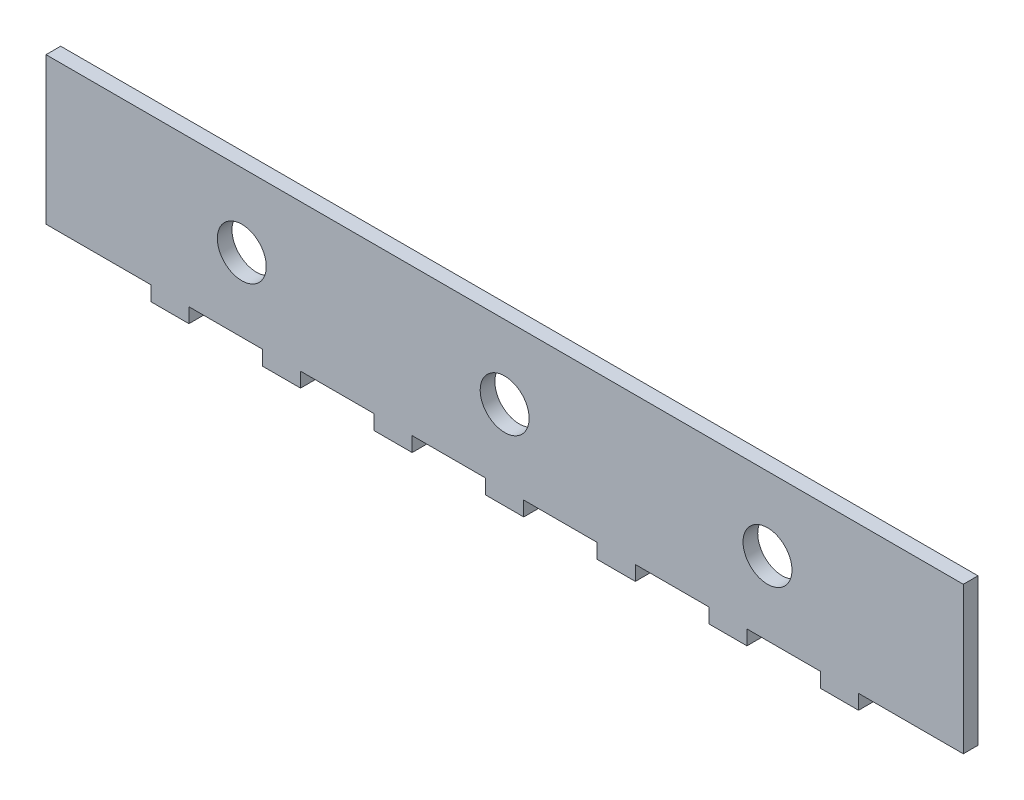
from build123d import *

# Parameters (mm, degrees)
SKETCH1_W           = 187.4
SKETCH1_H           = 30
BOSS_EXTRUDE1_DEPTH = 3
SKETCH2_W           = 7.8
SKETCH2_H           = 3
BOSS_EXTRUDE2_DEPTH = 3
LPATTERN2_COUNT     = 4
LPATTERN2_PITCH     = 22.8
LPATTERN2_COL_COUNT = 4
LPATTERN2_COL_PITCH = 22.8
SKETCH3_R           = 5
CUT_EXTRUDE1_DEPTH  = 96.460410642


with BuildPart() as part:
    # Sketch1 → Boss-Extrude1 (new body)
    with BuildSketch(Plane.XY):
        Rectangle(SKETCH1_W, SKETCH1_H)
    extrude(amount=BOSS_EXTRUDE1_DEPTH)

    # Sketch2 → Boss-Extrude2 (add)
    with BuildSketch(Plane.XZ.offset(15)):
        with Locations((0, 1.5)):
            Rectangle(SKETCH2_W, SKETCH2_H)
    boss_extrude2 = extrude(amount=BOSS_EXTRUDE2_DEPTH)

    # LPattern2: Boss-Extrude2 ×4
    with Locations(*[(i * LPATTERN2_PITCH, 0, 0) for i in range(1, LPATTERN2_COUNT)]):
        add(boss_extrude2)

    # LPattern2 col: Boss-Extrude2 ×4
    with Locations(*[(-i * LPATTERN2_COL_PITCH, 0, 0) for i in range(1, LPATTERN2_COL_COUNT)]):
        add(boss_extrude2)

    # Sketch3 → Cut-Extrude1 (cut, through all)
    with BuildSketch(Plane(origin=(0, 0, 0), x_dir=(-1, 0, 0), z_dir=(0, 0, -1))):
        Circle(SKETCH3_R)
        with Locations((-53.7, 0)):
            Circle(SKETCH3_R)
        with Locations((53.7, 0)):
            Circle(SKETCH3_R)
    extrude(amount=-CUT_EXTRUDE1_DEPTH, mode=Mode.SUBTRACT)


solid = part.part
